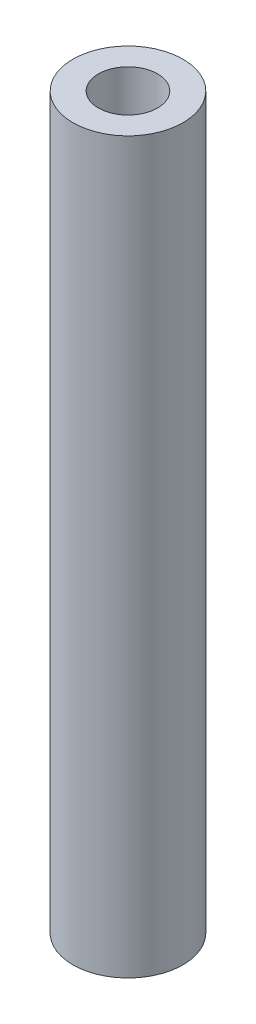
from build123d import *

# Parameters (mm, degrees)
SKETCH_1_R      = 4
SKETCH_1_R_2    = 2.15
EXTRUDE_1_DEPTH = 53


with BuildPart() as part:
    # 草图1 → 凸台-拉伸1 (new body)
    with BuildSketch(Plane(origin=(0, 0, 0), x_dir=(1, 0, 0), z_dir=(0, 1, 0))):
        with Locations(Location((0, 0, 0), (0, 0, 270))):
            Circle(SKETCH_1_R)
        with Locations(Location((0, 0, 0), (0, 0, 270))):
            Circle(SKETCH_1_R_2, mode=Mode.SUBTRACT)
    extrude(amount=EXTRUDE_1_DEPTH)


solid = part.part
